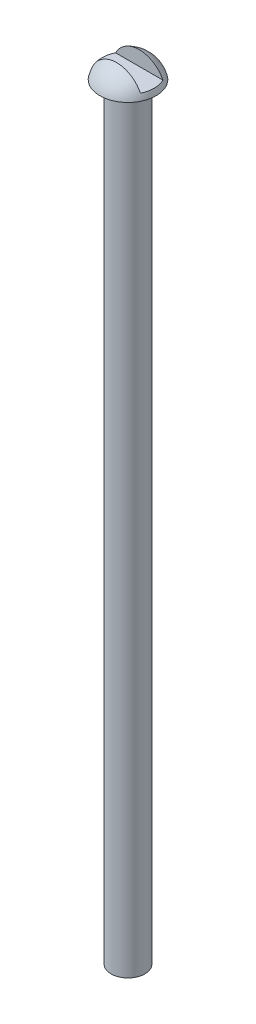
from build123d import *

# Parameters (mm, degrees)
ENL_V_START             = -0.5
ENL_V_MAT_EXTRU_1_DEPTH = 10


with BuildPart() as part:
    # Esquisse1 → Révolution1 (revolve)
    with BuildSketch(Plane.XY):
        with BuildLine():
            Line((2.5, 68), (1.5, 68))
            Line((1.5, 68), (1.5, 0))
            Line((1.5, 0), (0, 0))
            Line((0, 0), (0, 70))
            ThreePointArc((0, 70), (1.600781059, 69.438476324), (2.5, 68))
        make_face()
    revolve(axis=Axis((0, 0, 0), (0, 1, 0)))

    # Esquisse2 → Enlèv. mat.-Extru.1 (cut)
    with BuildSketch(Plane.XZ.offset(-68).offset(ENL_V_START)):
        with BuildLine():
            Line((2.5, 1), (-4.803104299, 1))
            ThreePointArc((-4.803104299, 1), (-5.803104299, 0), (-4.803104299, -1))
            Line((-4.803104299, -1), (2.5, -1))
            ThreePointArc((2.5, -1), (3.5, 0), (2.5, 1))
        make_face()
    extrude(amount=-ENL_V_MAT_EXTRU_1_DEPTH, mode=Mode.SUBTRACT)


solid = part.part
